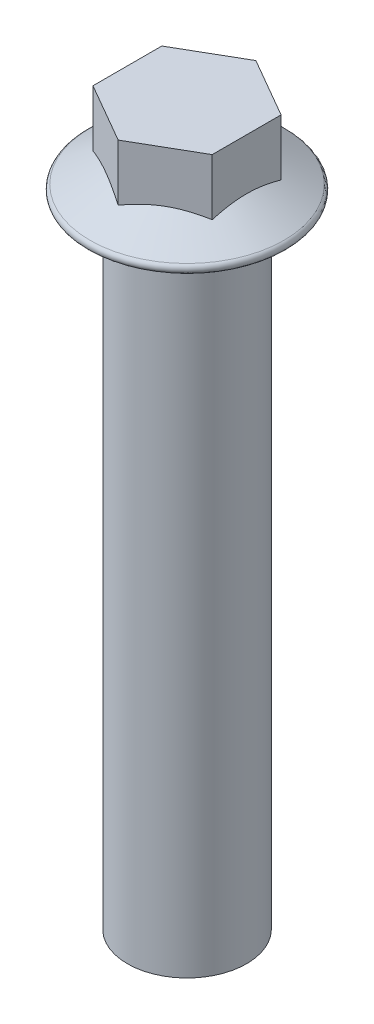
from build123d import *

# Parameters (mm, degrees)
SKETCH1_R                   = 9.525
BOSS_EXTRUDE1_DEPTH         = 101.6
BOSS_EXTRUDE2_DEPTH         = 13.096875
F_1_2_13_TAPPED_HOLE1_D     = 10.71626
F_1_2_13_TAPPED_HOLE1_DEPTH = 25.4
F_1_2_13_TAPPED_HOLE1_TIP   = 3.219489309


with BuildPart() as part:
    # Sketch1 → Boss-Extrude1 (new body)
    with BuildSketch(Plane(origin=(0, 0, 0), x_dir=(1, 0, 0), z_dir=(0, 1, 0))):
        with Locations(Location((0, 0, 0), (0, 0, 270))):
            Circle(SKETCH1_R)
    extrude(amount=BOSS_EXTRUDE1_DEPTH)

    # Sketch4 → Boss-Extrude2 (add)
    with BuildSketch(Plane(origin=(0, 101.6, 0), x_dir=(1, 0, 0), z_dir=(0, 1, 0))):
        Polygon((0, 10.998522628), (9.525, 5.499261314), (9.525, -5.499261314), (0, -10.998522628), (-9.525, -5.499261314), (-9.525, 5.499261314), align=None)
    extrude(amount=BOSS_EXTRUDE2_DEPTH)

    # Sketch5 → Revolve2 (revolve)
    with BuildSketch(Plane.XY, mode=Mode.PRIVATE) as revolve2_sk:
        with BuildLine():
            Line((0, 101.6), (-15.108296375, 101.6))
            ThreePointArc((-15.108296375, 101.6), (-15.875, 102.188312383), (-15.505171375, 103.081157664))
            Line((-15.505171375, 103.081157664), (0, 112.033072532))
            Line((0, 112.033072532), (0, 101.6))
        make_face()
    revolve(revolve2_sk.sketch.rotate(Axis((0, 101.6, 0), (0, 1, 0)), 180), axis=Axis((0, 101.6, 0), (0, 1, 0)))

    # 1/2-13 Tapped Hole1
    with Locations(Plane(origin=(0, 0, 0), x_dir=(-1, 0, 0), z_dir=(0, -1, 0))):
        with Locations((0, 0)):
            Hole(F_1_2_13_TAPPED_HOLE1_D / 2, depth=F_1_2_13_TAPPED_HOLE1_DEPTH)
            with Locations((0, 0, -(F_1_2_13_TAPPED_HOLE1_DEPTH + F_1_2_13_TAPPED_HOLE1_TIP / 2))):  # 118° drill point
                Cone(0, F_1_2_13_TAPPED_HOLE1_D / 2, F_1_2_13_TAPPED_HOLE1_TIP, mode=Mode.SUBTRACT)


solid = part.part
